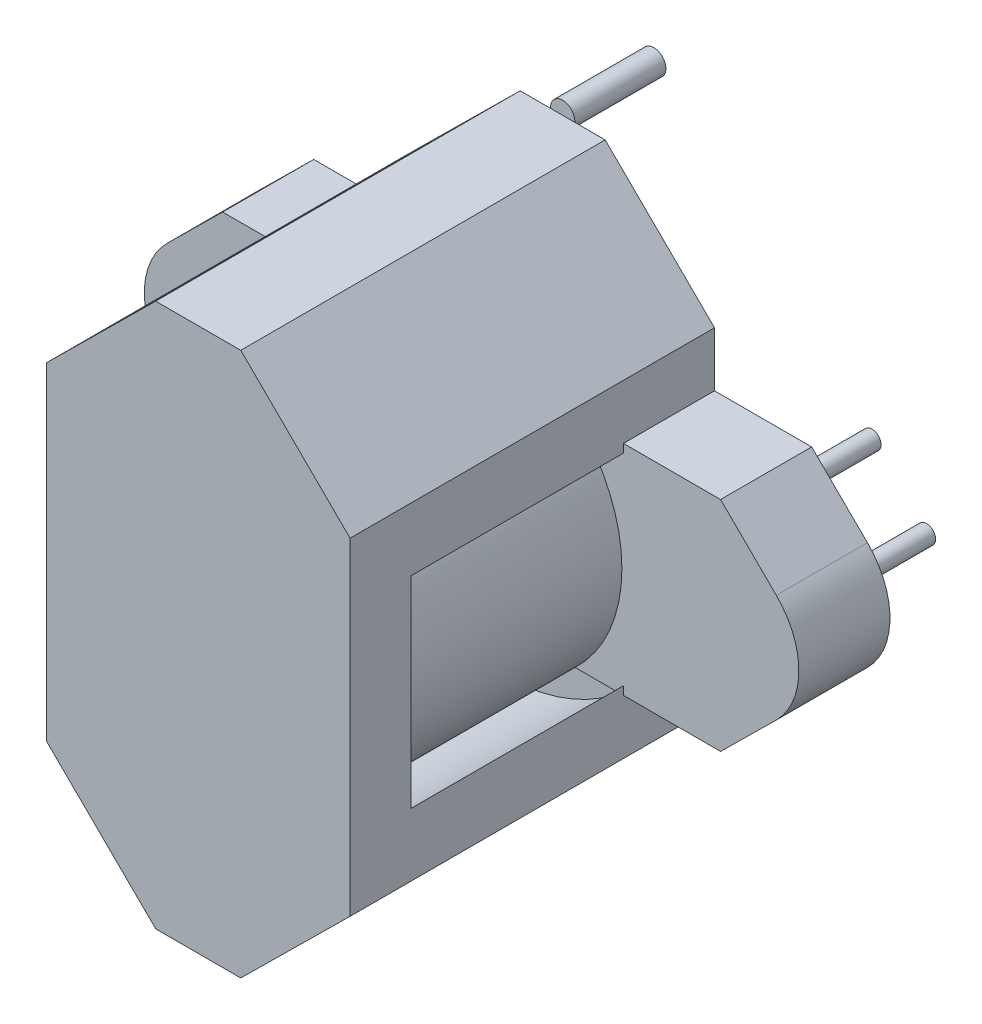
from build123d import *

# Parameters (mm, degrees)
EXTRUDE_1_DEPTH = 2
EXTRUDE_2_DEPTH = 8
EXTRUDE_3_DEPTH = 2
SKETCH_4_R      = 4.95
EXTRUDE_4_DEPTH = 8
EXTRUDE_5_DEPTH = 3
SKETCH_6_R      = 0.3
SKETCH_6_R_2    = 0.4
EXTRUDE_6_DEPTH = 3


with BuildPart() as part:
    # Эскиз1 → Бобышка-Вытянуть1 (new body)
    with BuildSketch(Plane.XY):
        Polygon((0, 17.9), (2.8, 17.9), (6.4, 14.342331177), (6.4, 3.557668823), (2.8, 0), (0, 0), (-3.6, 3.557668823), (-3.6, 14.342331177), align=None)
    extrude(amount=EXTRUDE_1_DEPTH)

    # Эскиз2 → Бобышка-Вытянуть2 (add)
    with BuildSketch(Plane.XY.offset(2)):
        with BuildLine():
            Line((6.4, 5.63337521), (6.4, 3.557668823))
            Line((6.4, 3.557668823), (2.8, 0))
            Line((2.8, 0), (0, 0))
            Line((0, 0), (-3.6, 3.557668823))
            Line((-3.6, 3.557668823), (-3.6, 5.63337521))
            ThreePointArc((-3.6, 5.63337521), (1.4, 2.95), (6.4, 5.63337521))
        make_face()
        with BuildLine():
            Line((-3.6, 12.26662479), (-3.6, 14.342331177))
            Line((-3.6, 14.342331177), (0, 17.9))
            Line((0, 17.9), (2.8, 17.9))
            Line((2.8, 17.9), (6.4, 14.342331177))
            Line((6.4, 14.342331177), (6.4, 12.26662479))
            ThreePointArc((6.4, 12.26662479), (1.4, 14.95), (-3.6, 12.26662479))
        make_face()
    extrude(amount=EXTRUDE_2_DEPTH)

    # Эскиз3 → Бобышка-Вытянуть3 (add)
    with BuildSketch(Plane.XY.offset(10)):
        Polygon((-3.6, 14.342331177), (-3.6, 3.557668823), (0, 0), (2.8, 0), (6.4, 3.557668823), (6.4, 14.342331177), (2.8, 17.9), (0, 17.9), align=None)
    extrude(amount=EXTRUDE_3_DEPTH)

    # Эскиз4 → Бобышка-Вытянуть4 (add)
    with BuildSketch(Plane.XY.offset(2)):
        with Locations(Location((1.4, 8.95, 0), (0, 0, 180))):
            Circle(SKETCH_4_R)
    extrude(amount=EXTRUDE_4_DEPTH)

    # Эскиз5 → Бобышка-Вытянуть5 (add)
    with BuildSketch(Plane.XY):
        with BuildLine():
            Line((9.599401359, 12.544204897), (-6.796786669, 12.544204897))
            Line((-6.796786669, 12.544204897), (-8.632281469, 10.730293057))
            ThreePointArc((-8.632281469, 10.730293057), (-9.375, 8.952102448), (-8.632281469, 7.17391184))
            Line((-8.632281469, 7.17391184), (-6.796786669, 5.36))
            Line((-6.796786669, 5.36), (9.599401359, 5.36))
            Line((9.599401359, 5.36), (11.434896159, 7.17391184))
            ThreePointArc((11.434896159, 7.17391184), (12.177614691, 8.952102448), (11.434896159, 10.730293057))
            Line((11.434896159, 10.730293057), (9.599401359, 12.544204897))
        make_face()
    extrude(amount=EXTRUDE_5_DEPTH)

    # Эскиз6 → Бобышка-Вытянуть6 (add)
    with BuildSketch(Plane.XY):
        with Locations((10.38, 8.950654336)):
            Circle(SKETCH_6_R)
        with Locations((8.584, 10.746654336)):
            Circle(SKETCH_6_R)
        with Locations((8.584, 7.156654336)):
            Circle(SKETCH_6_R)
        with Locations((-5.784, 10.746654336)):
            Circle(SKETCH_6_R)
        with Locations((-7.58, 8.950654336)):
            Circle(SKETCH_6_R)
        with Locations((-5.784, 7.156654336)):
            Circle(SKETCH_6_R)
        with Locations((1.4, 17.930654336)):
            Circle(SKETCH_6_R_2)
        with Locations((1.4, -0.029345664)):
            Circle(SKETCH_6_R_2)
    extrude(amount=-EXTRUDE_6_DEPTH)


solid = part.part
